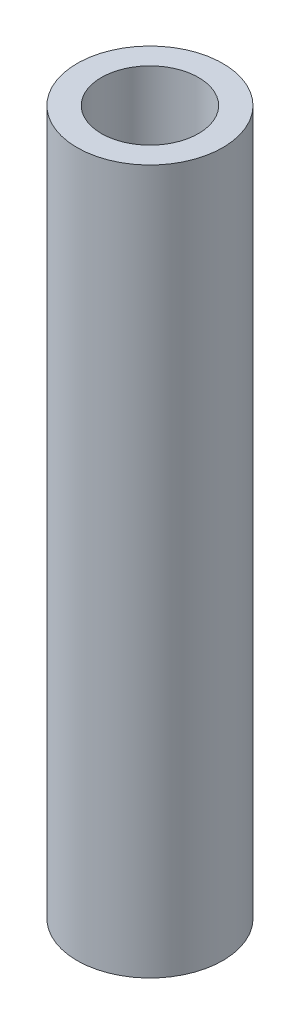
from build123d import *

# Parameters (mm, degrees)
SKETCH1_R           = 4.7625
SKETCH1_R_2         = 3.175
BOSS_EXTRUDE1_DEPTH = 46


with BuildPart() as part:
    # Sketch1 → Boss-Extrude1 (new body)
    with BuildSketch(Plane(origin=(0, 0, 0), x_dir=(1, 0, 0), z_dir=(0, 1, 0))):
        with Locations(Location((0, 0, 0), (0, 0, 270))):
            Circle(SKETCH1_R)
        with Locations(Location((0, 0, 0), (0, 0, 270))):
            Circle(SKETCH1_R_2, mode=Mode.SUBTRACT)
    extrude(amount=BOSS_EXTRUDE1_DEPTH)


solid = part.part
